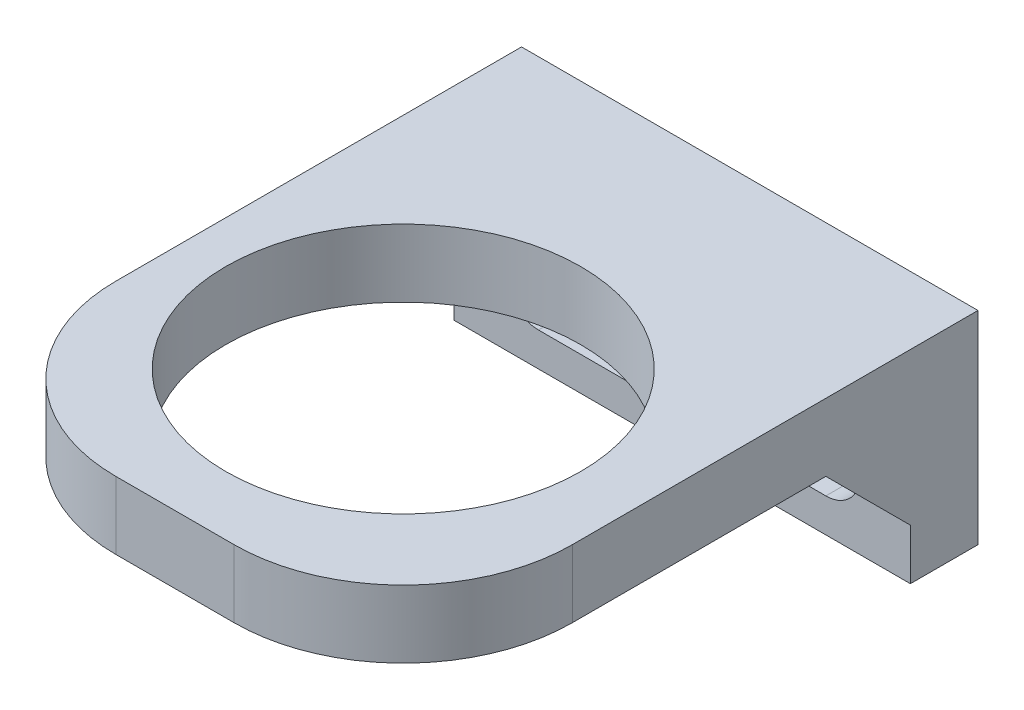
from build123d import *

# Parameters (mm, degrees)
ESQUISSE1_W             = 27
ESQUISSE1_H             = 34
ESQUISSE1_R             = 10.5
BOSS_EXTRU_1_DEPTH      = 4
ESQUISSE2_W             = 27
ESQUISSE2_H             = 4
BOSS_EXTRU_2_DEPTH      = 8
BOSS_EXTRU_3_DEPTH      = 2
BOSS_EXTRU_4_DEPTH      = 2
CONG_1_R                = 10
ENL_V_MAT_EXTRU_1_DEPTH = 35.058772732


with BuildPart() as part:
    # Esquisse1 → Boss.-Extru.1 (new body)
    with BuildSketch(Plane(origin=(0, 0, 0), x_dir=(1, 0, 0), z_dir=(0, 1, 0))):
        with Locations((0.5, 3)):
            Rectangle(ESQUISSE1_W, ESQUISSE1_H)
        with Locations(Location((0, 0, 0), (0, 0, 270))):
            Circle(ESQUISSE1_R, mode=Mode.SUBTRACT)
    extrude(amount=BOSS_EXTRU_1_DEPTH)

    # Esquisse2 → Boss.-Extru.2 (add)
    with BuildSketch(Plane.XZ):
        with Locations((0.5, -18)):
            Rectangle(ESQUISSE2_W, ESQUISSE2_H)
    extrude(amount=BOSS_EXTRU_2_DEPTH)

    # Esquisse5 → Boss.-Extru.3 (add)
    with BuildSketch(Plane.ZY.offset(13)):
        Polygon((-16, 0), (-16, -5), (-11, 0), align=None)
    extrude(amount=-BOSS_EXTRU_3_DEPTH)

    # Esquisse6 → Boss.-Extru.4 (add)
    with BuildSketch(Plane(origin=(14, 0, 0), x_dir=(0, 0, -1), z_dir=(1, 0, 0))):
        Polygon((16, 0), (11, 0), (16, -5), align=None)
    extrude(amount=-BOSS_EXTRU_4_DEPTH)

    # Congé1
    cong_1_edges = [part.edges().sort_by_distance(p)[0] for p in [
        (-13, 2, 14),
        (14, 2, 14),
    ]]
    fillet(cong_1_edges, radius=CONG_1_R)

    # Esquisse7 → Enlèv. mat.-Extru.1 (cut, through all)
    with BuildSketch(Plane.XY.offset(-16)):
        with BuildLine():
            Line((-8, -2), (9, -2))
            ThreePointArc((9, -2), (11, -4), (9, -6))
            Line((9, -6), (-8, -6))
            ThreePointArc((-8, -6), (-10, -4), (-8, -2))
        make_face()
    extrude(amount=-ENL_V_MAT_EXTRU_1_DEPTH, mode=Mode.SUBTRACT)


solid = part.part
